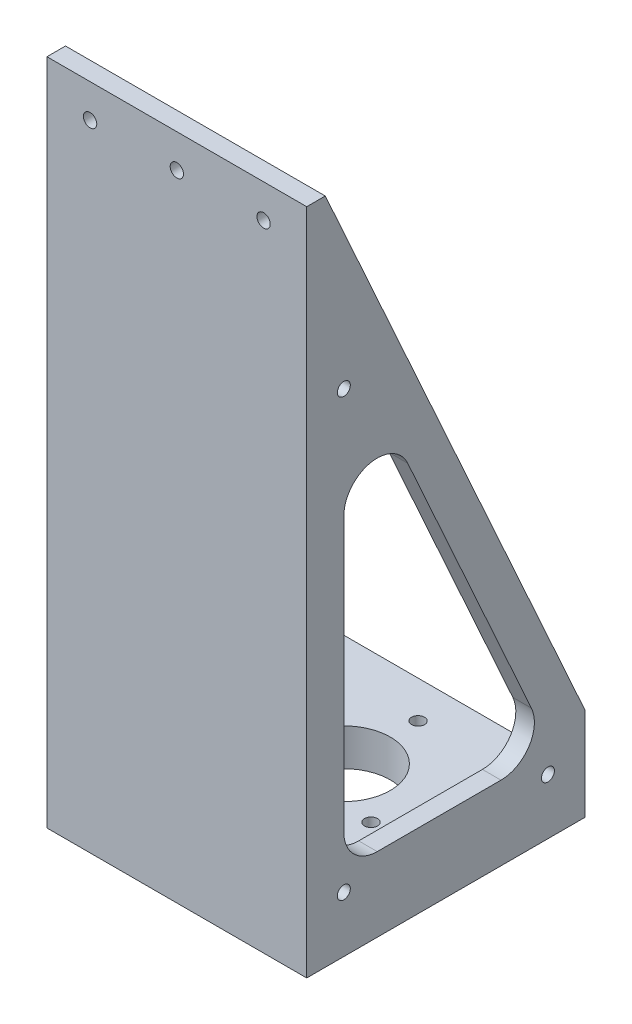
from build123d import *

# Parameters (mm, degrees)
SKETCH_1_W          = 70
SKETCH_1_H          = 75
SKETCH_1_R          = 12.5
SKETCH_1_R_2        = 1.75
EXTRUDE_1_DEPTH     = 10
EXTRUDE_3_DEPTH     = 5
EXTRUDE_4_DEPTH     = 5
SKETCH_7_W          = 70
SKETCH_7_H          = 180
EXTRUDE_5_DEPTH     = 5
SKETCH_10_R         = 1.8
CUT_EXTRUDE_2_DEPTH = 197.277864264
SKETCH_11_R         = 1.75
CUT_EXTRUDE_3_DEPTH = 199.305320151


with BuildPart() as part:
    # 草图1 → 凸台-拉伸1 (new body)
    with BuildSketch(Plane(origin=(0, 0, 0), x_dir=(1, 0, 0), z_dir=(0, 1, 0))):
        with Locations((0, -7.5)):
            Rectangle(SKETCH_1_W, SKETCH_1_H)
        with Locations(Location((0, 0, 0), (0, 0, 270))):
            Circle(SKETCH_1_R, mode=Mode.SUBTRACT)
        with Locations(Location((0, 20, 0), (0, 0, 270))):
            Circle(SKETCH_1_R_2, mode=Mode.SUBTRACT)
        with Locations(Location((17.320508076, -10, 0), (0, 0, 270))):
            Circle(SKETCH_1_R_2, mode=Mode.SUBTRACT)
        with Locations(Location((-17.320508076, -10, 0), (0, 0, 270))):
            Circle(SKETCH_1_R_2, mode=Mode.SUBTRACT)
    extrude(amount=EXTRUDE_1_DEPTH)

    # 草图6 → 凸台-拉伸3 (add)
    with BuildSketch(Plane.ZY.offset(35)):
        Polygon((40, 180), (-30, 25), (-30, 0), (45, 0), (45, 180), align=None)
    extrude(amount=-EXTRUDE_3_DEPTH)

    # 草图8 → 凸台-拉伸4 (add)
    with BuildSketch(Plane(origin=(35, 0, 0), x_dir=(0, 0, -1), z_dir=(1, 0, 0))):
        Polygon((-45, 0), (-45, 180), (-40, 180), (30, 25), (30, 0), align=None)
    extrude(amount=-EXTRUDE_4_DEPTH)

    # 草图7 → 凸台-拉伸5 (add)
    with BuildSketch(Plane.XY.offset(45)):
        with Locations((0, 90)):
            Rectangle(SKETCH_7_W, SKETCH_7_H)
    extrude(amount=-EXTRUDE_5_DEPTH)

    # 草图10 → 切除-拉伸2 (cut, through all)
    with BuildSketch(Plane(origin=(0, 0, 40), x_dir=(-1, 0, 0), z_dir=(0, 0, -1))):
        with Locations((-23.375, 171)):
            Circle(SKETCH_10_R)
        with Locations((23.375, 171)):
            Circle(SKETCH_10_R)
        with Locations((0, 171)):
            Circle(SKETCH_10_R)
    extrude(amount=-CUT_EXTRUDE_2_DEPTH, mode=Mode.SUBTRACT)

    # 草图11 → 切除-拉伸3 (cut, through all)
    with BuildSketch(Plane.ZY.offset(35)):
        with Locations((35, 132.484247104)):
            Circle(SKETCH_11_R)
        with Locations((35, 15)):
            Circle(SKETCH_11_R)
        with Locations((-20, 15)):
            Circle(SKETCH_11_R)
        with BuildLine():
            Line((35, 102.837189188), (35, 29))
            ThreePointArc((35, 29), (32.363961031, 22.636038969), (26, 20))
            Line((26, 20), (-7.345827375, 20))
            ThreePointArc((-7.345827375, 20), (-14.906863168, 24.118326338), (-15.548162772, 32.704280502))
            Line((-15.548162772, 32.704280502), (17.797664603, 106.54146969))
            ThreePointArc((17.797664603, 106.54146969), (27.894595132, 111.63551342), (35, 102.837189188))
        make_face()
    extrude(amount=-CUT_EXTRUDE_3_DEPTH, mode=Mode.SUBTRACT)


solid = part.part
